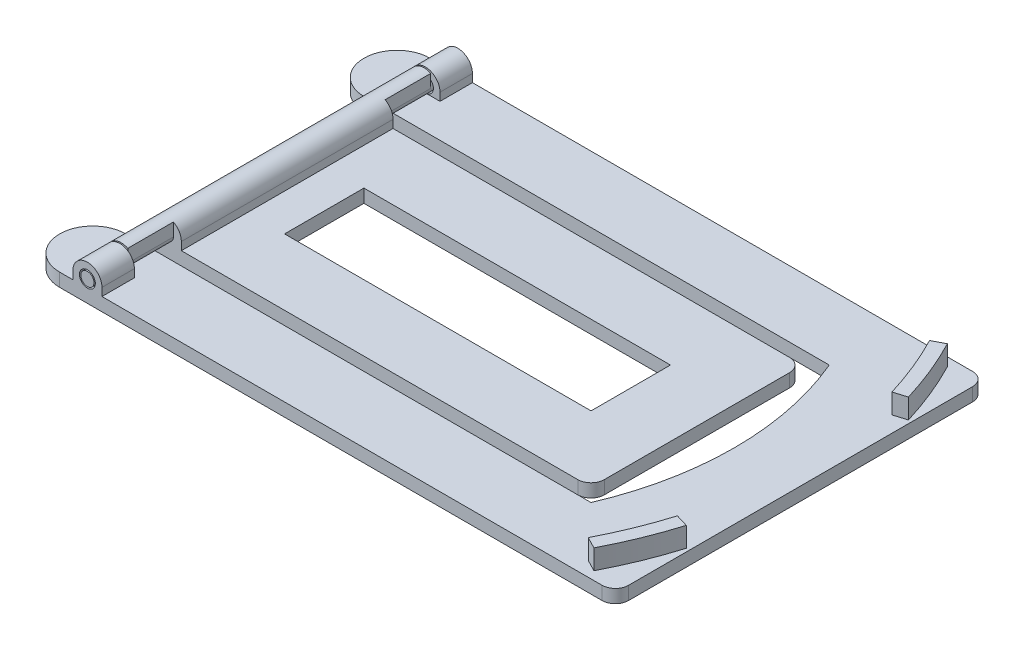
from build123d import *
from build123d.topology import SkipClean

# Parameters (mm, degrees)
BOSS_EXTRUDE_BASE_PLATE_DEPTH         = 2
BASE_PLATE_W                          = 66.332020977
BASE_PLATE_H                          = 32
BASE_PLATE_W_2                        = 46.332020977
BASE_PLATE_H_2                        = 12
BOSS_EXTRUDE_BASE_PLATE_2_DEPTH       = 2
EXTRUDE_THIN_RISERS_DEPTH             = 5
BOSS_EXTRUDE_START                    = 28
BOSS_EXTRUDE_HINGE_BODY_DEPTH         = 56
FILLET_LEGS_R                         = 2
CUT_EXTRUDE_START                     = 28
CUT_EXTRUDE_HINGE_PIN_LHS_DEPTH       = 5
CUT_EXTRUDE_START_2                   = 23
CUT_EXTRUDE_HINGE_SEPARATOR_LHS_DEPTH = 0.1
CUT_EXTRUDE_START_3                   = 16
CUT_EXTRUDE_HINGE_LIMITER_LHS_DEPTH   = 6.9
CUT_EXTRUDE_START_4                   = -23
CUT_EXTRUDE_HINGE_PIN_RHS_DEPTH       = 5
CUT_EXTRUDE_HINGE_SEPARATOR_RHS_DEPTH = 0.1
CUT_EXTRUDE_START_5                   = -22.9
CUT_EXTRUDE_HINGE_LIMITER_RHS_DEPTH   = 6.9


with BuildPart() as part:
    # Base plate → Boss-Extrude base plate (new body)
    with BuildSketch(Plane(origin=(0, 0, 0), x_dir=(1, 0, 0), z_dir=(0, 1, 0))):
        with BuildLine():
            Line((-28, 18), (42.332020977, 18))
            ThreePointArc((42.332020977, 18), (46, 0), (42.332020977, -18))
            Line((42.332020977, -18), (-28, -18))
            ThreePointArc((-28, -18), (-33, -23), (-28, -28))
            Line((-28, -28), (48.497422612, -28))
            Line((48.497422612, -28), (56, -28))
            Line((56, -28), (56, 28))
            Line((56, 28), (48.497422612, 28))
            Line((48.497422612, 28), (-28, 28))
            ThreePointArc((-28, 28), (-33, 23), (-28, 18))
        make_face()
    extrude(amount=BOSS_EXTRUDE_BASE_PLATE_DEPTH)

    # Sketch1<5> → Extrude-Thin risers (add)
    with BuildSketch(Plane(origin=(0, 0, 0), x_dir=(1, 0, 0), z_dir=(0, 1, 0))):
        with BuildLine():
            ThreePointArc((49.705170747, 25.795270904), (51.875157412, 21.094265653), (53.601686044, 16.212934751))
            Line((53.601686044, 16.212934751), (55.516031974, 16.791968135))
            ThreePointArc((55.516031974, 16.791968135), (53.727841606, 21.847632284), (51.480355417, 26.716530579))
            Line((51.480355417, 26.716530579), (49.705170747, 25.795270904))
        make_face()
        with BuildLine():
            ThreePointArc((53.601686044, -16.212934751), (51.875157412, -21.094265653), (49.705170747, -25.795270904))
            Line((49.705170747, -25.795270904), (51.480355417, -26.716530579))
            ThreePointArc((51.480355417, -26.716530579), (53.727841606, -21.847632284), (55.516031974, -16.791968135))
            Line((55.516031974, -16.791968135), (53.601686044, -16.212934751))
        make_face()
    extrude(amount=EXTRUDE_THIN_RISERS_DEPTH)



with BuildPart() as body_2:
    # Base plate → Boss-Extrude base plate 2 (new body)
    with BuildSketch(Plane(origin=(0, 0, 0), x_dir=(1, 0, 0), z_dir=(0, 1, 0))):
        with Locations((7.166010488, 0)):
            Rectangle(BASE_PLATE_W, BASE_PLATE_H)
        with Locations((7.166010489, 0)):
            Rectangle(BASE_PLATE_W_2, BASE_PLATE_H_2, mode=Mode.SUBTRACT)
    extrude(amount=BOSS_EXTRUDE_BASE_PLATE_2_DEPTH)


with BuildPart() as part_1:
    add(part.part)

    add(body_2.part)  # Boss-Extrude hinge body merges body 2
    # Hinge → Boss-Extrude hinge body (add)
    with BuildSketch(Plane.XY.offset(BOSS_EXTRUDE_START)):
        with BuildLine():
            Line((-26, 3.2), (-26, 2))
            Line((-26, 2), (-21.6, 2))
            Line((-21.6, 2), (-21.6, 3.2))
            ThreePointArc((-21.6, 3.2), (-23.8, 5.4), (-26, 3.2))
        make_face()
    extrude(amount=-BOSS_EXTRUDE_HINGE_BODY_DEPTH)

    # Fillet legs
    fillet_legs_edges = [part_1.edges().sort_by_distance(p)[0] for p in [
        (56, 1, -28),
        (56, 1, 28),
        (40.332020977, 1, -16),
        (40.332020977, 1, 16),
    ]]
    fillet(fillet_legs_edges, radius=FILLET_LEGS_R)

    # Hinge<3> → Cut-Extrude hinge pin LHS (cut)
    with BuildSketch(Plane.XY.offset(CUT_EXTRUDE_START)):
        with BuildLine():
            ThreePointArc((-23.8, 2.2), (-24.507106781, 3.907106781), (-22.8, 3.2))
            Line((-22.8, 3.2), (-22.8, 3.863324958))
            ThreePointArc((-22.8, 3.863324958), (-24.648528137, 4.048528137), (-24.463324958, 2.2))
            Line((-24.463324958, 2.2), (-23.8, 2.2))
        make_face()
        with BuildLine():
            Line((-22.8, 3.863324958), (-22.8, 3.2))
            ThreePointArc((-22.8, 3.2), (-23.092893219, 2.492893219), (-23.8, 2.2))
            Line((-23.8, 2.2), (-24.463324958, 2.2))
            ThreePointArc((-24.463324958, 2.2), (-24.146410162, 2.051087471), (-23.8, 2))
            ThreePointArc((-23.8, 2), (-22.951471863, 2.351471863), (-22.6, 3.2))
            ThreePointArc((-22.6, 3.2), (-22.651087471, 3.546410162), (-22.8, 3.863324958))
        make_face()
    extrude(amount=-CUT_EXTRUDE_HINGE_PIN_LHS_DEPTH, mode=Mode.SUBTRACT)

    # Hinge<4> → Cut-Extrude hinge separator LHS (cut, symmetric)
    with SkipClean():  # the faces are left unmerged after this step: merging them gives an invalid solid
        with BuildSketch(Plane.XY.offset(CUT_EXTRUDE_START_2)):
            with BuildLine():
                ThreePointArc((-24.463324958, 2.2), (-24.648528137, 4.048528137), (-22.8, 3.863324958))
                Line((-22.8, 3.863324958), (-22.8, 5.159591794))
                ThreePointArc((-22.8, 5.159591794), (-24.948912529, 5.076166304), (-26, 3.2))
                Line((-26, 3.2), (-26, 2.2))
                Line((-26, 2.2), (-24.463324958, 2.2))
            make_face()
            with BuildLine():
                Line((-22.8, 5.159591794), (-22.8, 3.863324958))
                ThreePointArc((-22.8, 3.863324958), (-22.651087471, 3.546410162), (-22.6, 3.2))
                ThreePointArc((-22.6, 3.2), (-22.951471863, 2.351471863), (-23.8, 2))
                Line((-23.8, 2), (-21.6, 2))
                Line((-21.6, 2), (-21.6, 3.2))
                ThreePointArc((-21.6, 3.2), (-21.923833696, 4.348912529), (-22.8, 5.159591794))
            make_face()
            with BuildLine():
                ThreePointArc((-23.8, 2.2), (-24.507106781, 3.907106781), (-22.8, 3.2))
                Line((-22.8, 3.2), (-22.8, 3.863324958))
                ThreePointArc((-22.8, 3.863324958), (-24.648528137, 4.048528137), (-24.463324958, 2.2))
                Line((-24.463324958, 2.2), (-23.8, 2.2))
            make_face()
            with BuildLine():
                Line((-22.8, 3.863324958), (-22.8, 3.2))
                ThreePointArc((-22.8, 3.2), (-23.092893219, 2.492893219), (-23.8, 2.2))
                Line((-23.8, 2.2), (-24.463324958, 2.2))
                ThreePointArc((-24.463324958, 2.2), (-24.146410162, 2.051087471), (-23.8, 2))
                ThreePointArc((-23.8, 2), (-22.951471863, 2.351471863), (-22.6, 3.2))
                ThreePointArc((-22.6, 3.2), (-22.651087471, 3.546410162), (-22.8, 3.863324958))
            make_face()
            with BuildLine():
                ThreePointArc((-23.8, 2), (-24.146410162, 2.051087471), (-24.463324958, 2.2))
                Line((-24.463324958, 2.2), (-26, 2.2))
                Line((-26, 2.2), (-26, 2))
                Line((-26, 2), (-23.8, 2))
            make_face()
        extrude(amount=CUT_EXTRUDE_HINGE_SEPARATOR_LHS_DEPTH, both=True, mode=Mode.SUBTRACT)

    # Hinge<5> → Cut-Extrude hinge limiter LHS (cut)
    with BuildSketch(Plane.XY.offset(CUT_EXTRUDE_START_3)):
        with BuildLine():
            ThreePointArc((-23.8, 2), (-24.146410162, 2.051087471), (-24.463324958, 2.2))
            Line((-24.463324958, 2.2), (-26, 2.2))
            Line((-26, 2.2), (-26, 2))
            Line((-26, 2), (-23.8, 2))
        make_face()
        with BuildLine():
            Line((-22.8, 3.863324958), (-22.8, 3.2))
            ThreePointArc((-22.8, 3.2), (-23.092893219, 2.492893219), (-23.8, 2.2))
            Line((-23.8, 2.2), (-24.463324958, 2.2))
            ThreePointArc((-24.463324958, 2.2), (-24.146410162, 2.051087471), (-23.8, 2))
            ThreePointArc((-23.8, 2), (-22.951471863, 2.351471863), (-22.6, 3.2))
            ThreePointArc((-22.6, 3.2), (-22.651087471, 3.546410162), (-22.8, 3.863324958))
        make_face()
        with BuildLine():
            Line((-22.8, 5.159591794), (-22.8, 3.863324958))
            ThreePointArc((-22.8, 3.863324958), (-22.651087471, 3.546410162), (-22.6, 3.2))
            ThreePointArc((-22.6, 3.2), (-22.951471863, 2.351471863), (-23.8, 2))
            Line((-23.8, 2), (-21.6, 2))
            Line((-21.6, 2), (-21.6, 3.2))
            ThreePointArc((-21.6, 3.2), (-21.923833696, 4.348912529), (-22.8, 5.159591794))
        make_face()
    extrude(amount=CUT_EXTRUDE_HINGE_LIMITER_LHS_DEPTH, mode=Mode.SUBTRACT)

    # Hinge<6> → Cut-Extrude hinge pin RHS (cut)
    with BuildSketch(Plane.XY.offset(CUT_EXTRUDE_START_4)):
        with BuildLine():
            ThreePointArc((-23.8, 2.2), (-24.507106781, 3.907106781), (-22.8, 3.2))
            Line((-22.8, 3.2), (-22.8, 3.863324958))
            ThreePointArc((-22.8, 3.863324958), (-24.648528137, 4.048528137), (-24.463324958, 2.2))
            Line((-24.463324958, 2.2), (-23.8, 2.2))
        make_face()
        with BuildLine():
            Line((-22.8, 3.863324958), (-22.8, 3.2))
            ThreePointArc((-22.8, 3.2), (-23.092893219, 2.492893219), (-23.8, 2.2))
            Line((-23.8, 2.2), (-24.463324958, 2.2))
            ThreePointArc((-24.463324958, 2.2), (-24.146410162, 2.051087471), (-23.8, 2))
            ThreePointArc((-23.8, 2), (-22.951471863, 2.351471863), (-22.6, 3.2))
            ThreePointArc((-22.6, 3.2), (-22.651087471, 3.546410162), (-22.8, 3.863324958))
        make_face()
    extrude(amount=-CUT_EXTRUDE_HINGE_PIN_RHS_DEPTH, mode=Mode.SUBTRACT)

    # Hinge<7> → Cut-Extrude hinge separator RHS (cut, symmetric)
    with SkipClean():  # the faces are left unmerged after this step: merging them gives an invalid solid
        with BuildSketch(Plane.XY.offset(CUT_EXTRUDE_START_4)):
            with BuildLine():
                Line((-22.8, 5.159591794), (-22.8, 3.863324958))
                ThreePointArc((-22.8, 3.863324958), (-22.651087471, 3.546410162), (-22.6, 3.2))
                ThreePointArc((-22.6, 3.2), (-22.951471863, 2.351471863), (-23.8, 2))
                Line((-23.8, 2), (-21.6, 2))
                Line((-21.6, 2), (-21.6, 3.2))
                ThreePointArc((-21.6, 3.2), (-21.923833696, 4.348912529), (-22.8, 5.159591794))
            make_face()
            with BuildLine():
                ThreePointArc((-24.463324958, 2.2), (-24.648528137, 4.048528137), (-22.8, 3.863324958))
                Line((-22.8, 3.863324958), (-22.8, 5.159591794))
                ThreePointArc((-22.8, 5.159591794), (-24.948912529, 5.076166304), (-26, 3.2))
                Line((-26, 3.2), (-26, 2.2))
                Line((-26, 2.2), (-24.463324958, 2.2))
            make_face()
            with BuildLine():
                ThreePointArc((-23.8, 2), (-24.146410162, 2.051087471), (-24.463324958, 2.2))
                Line((-24.463324958, 2.2), (-26, 2.2))
                Line((-26, 2.2), (-26, 2))
                Line((-26, 2), (-23.8, 2))
            make_face()
            with BuildLine():
                ThreePointArc((-23.8, 2.2), (-24.507106781, 3.907106781), (-22.8, 3.2))
                Line((-22.8, 3.2), (-22.8, 3.863324958))
                ThreePointArc((-22.8, 3.863324958), (-24.648528137, 4.048528137), (-24.463324958, 2.2))
                Line((-24.463324958, 2.2), (-23.8, 2.2))
            make_face()
            with BuildLine():
                Line((-22.8, 3.863324958), (-22.8, 3.2))
                ThreePointArc((-22.8, 3.2), (-23.092893219, 2.492893219), (-23.8, 2.2))
                Line((-23.8, 2.2), (-24.463324958, 2.2))
                ThreePointArc((-24.463324958, 2.2), (-24.146410162, 2.051087471), (-23.8, 2))
                ThreePointArc((-23.8, 2), (-22.951471863, 2.351471863), (-22.6, 3.2))
                ThreePointArc((-22.6, 3.2), (-22.651087471, 3.546410162), (-22.8, 3.863324958))
            make_face()
        extrude(amount=CUT_EXTRUDE_HINGE_SEPARATOR_RHS_DEPTH, both=True, mode=Mode.SUBTRACT)

    # Hinge<8> → Cut-Extrude hinge limiter RHS (cut)
    with BuildSketch(Plane.XY.offset(CUT_EXTRUDE_START_5)):
        with BuildLine():
            ThreePointArc((-23.8, 2), (-24.146410162, 2.051087471), (-24.463324958, 2.2))
            Line((-24.463324958, 2.2), (-26, 2.2))
            Line((-26, 2.2), (-26, 2))
            Line((-26, 2), (-23.8, 2))
        make_face()
        with BuildLine():
            Line((-22.8, 3.863324958), (-22.8, 3.2))
            ThreePointArc((-22.8, 3.2), (-23.092893219, 2.492893219), (-23.8, 2.2))
            Line((-23.8, 2.2), (-24.463324958, 2.2))
            ThreePointArc((-24.463324958, 2.2), (-24.146410162, 2.051087471), (-23.8, 2))
            ThreePointArc((-23.8, 2), (-22.951471863, 2.351471863), (-22.6, 3.2))
            ThreePointArc((-22.6, 3.2), (-22.651087471, 3.546410162), (-22.8, 3.863324958))
        make_face()
        with BuildLine():
            Line((-22.8, 5.159591794), (-22.8, 3.863324958))
            ThreePointArc((-22.8, 3.863324958), (-22.651087471, 3.546410162), (-22.6, 3.2))
            ThreePointArc((-22.6, 3.2), (-22.951471863, 2.351471863), (-23.8, 2))
            Line((-23.8, 2), (-21.6, 2))
            Line((-21.6, 2), (-21.6, 3.2))
            ThreePointArc((-21.6, 3.2), (-21.923833696, 4.348912529), (-22.8, 5.159591794))
        make_face()
    extrude(amount=CUT_EXTRUDE_HINGE_LIMITER_RHS_DEPTH, mode=Mode.SUBTRACT)


with BuildPart() as cut_extrude_hinge_limiter_rhs_piece_1:
    # of the separate pieces the step leaves, piece 1, a body of its own (cut_extrude_hinge_limiter_rhs_pieces)
    add(part_1.part.solids().sort_by_distance((54, 0, 28))[0])


with BuildPart() as cut_extrude_hinge_limiter_rhs_piece_2:
    # of the separate pieces the step leaves, piece 2, a body of its own (cut_extrude_hinge_limiter_rhs_pieces)
    add(part_1.part.solids().sort_by_distance((38.332020977, 0, -16))[0])


solid = Compound([cut_extrude_hinge_limiter_rhs_piece_1.part, cut_extrude_hinge_limiter_rhs_piece_2.part])
